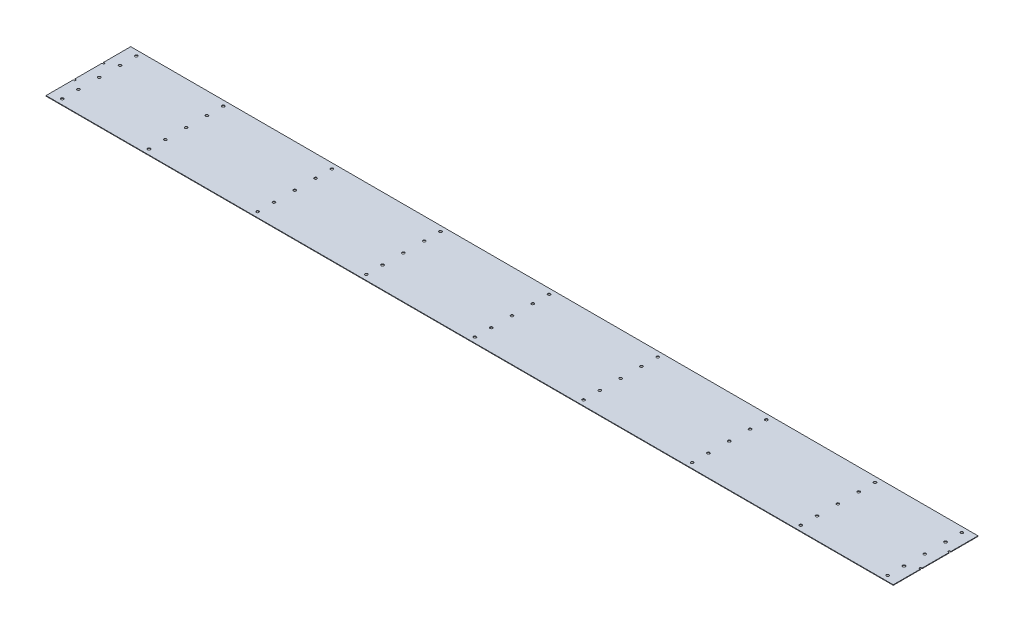
from build123d import *

# Parameters (mm, degrees)
SKETCH1_R           = 2.45
BOSS_EXTRUDE1_DEPTH = 1


with BuildPart() as part:
    # Sketch1 → Boss-Extrude1 (new body)
    with BuildSketch(Plane(origin=(0, 0, 0), x_dir=(1, 0, 0), z_dir=(0, 1, 0))):
        Polygon((-780, -25), (-780, 25), (-777, 25), (-777, 28), (-780, 28), (-780, 78), (780, 78), (780, 28), (777, 28), (777, 25), (780, 25), (780, -25), (777, -25), (777, -28), (780, -28), (780, -78), (-780, -78), (-780, -28), (-777, -28), (-777, -25), align=None)
        with Locations(Location((0, 68.3, 0), (0, 0, 270))):
            Circle(SKETCH1_R, mode=Mode.SUBTRACT)
        with Locations(Location((0, 38.3, 0), (0, 0, 270))):
            Circle(SKETCH1_R, mode=Mode.SUBTRACT)
        with Locations(Location((0, -38.3, 0), (0, 0, 270))):
            Circle(SKETCH1_R, mode=Mode.SUBTRACT)
        with Locations(Location((0, -68.3, 0), (0, 0, 270))):
            Circle(SKETCH1_R, mode=Mode.SUBTRACT)
        with Locations(Location((0, 0, 0), (0, 0, 270))):
            Circle(SKETCH1_R, mode=Mode.SUBTRACT)
        with Locations(Location((200, 68.3, 0), (0, 0, 270))):
            Circle(SKETCH1_R, mode=Mode.SUBTRACT)
        with Locations(Location((200, 38.3, 0), (0, 0, 270))):
            Circle(SKETCH1_R, mode=Mode.SUBTRACT)
        with Locations(Location((200, 0, 0), (0, 0, 270))):
            Circle(SKETCH1_R, mode=Mode.SUBTRACT)
        with Locations(Location((200, -38.3, 0), (0, 0, 270))):
            Circle(SKETCH1_R, mode=Mode.SUBTRACT)
        with Locations(Location((200, -68.3, 0), (0, 0, 270))):
            Circle(SKETCH1_R, mode=Mode.SUBTRACT)
        with Locations(Location((400, 68.3, 0), (0, 0, 270))):
            Circle(SKETCH1_R, mode=Mode.SUBTRACT)
        with Locations(Location((400, 38.3, 0), (0, 0, 270))):
            Circle(SKETCH1_R, mode=Mode.SUBTRACT)
        with Locations(Location((400, 0, 0), (0, 0, 270))):
            Circle(SKETCH1_R, mode=Mode.SUBTRACT)
        with Locations(Location((400, -38.3, 0), (0, 0, 270))):
            Circle(SKETCH1_R, mode=Mode.SUBTRACT)
        with Locations(Location((400, -68.3, 0), (0, 0, 270))):
            Circle(SKETCH1_R, mode=Mode.SUBTRACT)
        with Locations(Location((600, 68.3, 0), (0, 0, 270))):
            Circle(SKETCH1_R, mode=Mode.SUBTRACT)
        with Locations(Location((600, 38.3, 0), (0, 0, 270))):
            Circle(SKETCH1_R, mode=Mode.SUBTRACT)
        with Locations(Location((600, 0, 0), (0, 0, 270))):
            Circle(SKETCH1_R, mode=Mode.SUBTRACT)
        with Locations(Location((600, -38.3, 0), (0, 0, 270))):
            Circle(SKETCH1_R, mode=Mode.SUBTRACT)
        with Locations(Location((600, -68.3, 0), (0, 0, 270))):
            Circle(SKETCH1_R, mode=Mode.SUBTRACT)
        with Locations(Location((-200, -68.3, 0), (0, 0, 270))):
            Circle(SKETCH1_R, mode=Mode.SUBTRACT)
        with Locations(Location((-200, -38.3, 0), (0, 0, 270))):
            Circle(SKETCH1_R, mode=Mode.SUBTRACT)
        with Locations(Location((-200, 0, 0), (0, 0, 270))):
            Circle(SKETCH1_R, mode=Mode.SUBTRACT)
        with Locations(Location((-200, 38.3, 0), (0, 0, 270))):
            Circle(SKETCH1_R, mode=Mode.SUBTRACT)
        with Locations(Location((-200, 68.3, 0), (0, 0, 270))):
            Circle(SKETCH1_R, mode=Mode.SUBTRACT)
        with Locations(Location((-400, -68.3, 0), (0, 0, 270))):
            Circle(SKETCH1_R, mode=Mode.SUBTRACT)
        with Locations(Location((-400, -38.3, 0), (0, 0, 270))):
            Circle(SKETCH1_R, mode=Mode.SUBTRACT)
        with Locations(Location((-400, 0, 0), (0, 0, 270))):
            Circle(SKETCH1_R, mode=Mode.SUBTRACT)
        with Locations(Location((-400, 38.3, 0), (0, 0, 270))):
            Circle(SKETCH1_R, mode=Mode.SUBTRACT)
        with Locations(Location((-400, 68.3, 0), (0, 0, 270))):
            Circle(SKETCH1_R, mode=Mode.SUBTRACT)
        with Locations(Location((-600, -68.3, 0), (0, 0, 270))):
            Circle(SKETCH1_R, mode=Mode.SUBTRACT)
        with Locations(Location((-600, -38.3, 0), (0, 0, 270))):
            Circle(SKETCH1_R, mode=Mode.SUBTRACT)
        with Locations(Location((-600, 0, 0), (0, 0, 270))):
            Circle(SKETCH1_R, mode=Mode.SUBTRACT)
        with Locations(Location((-600, 38.3, 0), (0, 0, 270))):
            Circle(SKETCH1_R, mode=Mode.SUBTRACT)
        with Locations(Location((-600, 68.3, 0), (0, 0, 270))):
            Circle(SKETCH1_R, mode=Mode.SUBTRACT)
        with Locations(Location((-760, 68.3, 0), (0, 0, 270))):
            Circle(SKETCH1_R, mode=Mode.SUBTRACT)
        with Locations(Location((-760, 38.3, 0), (0, 0, 270))):
            Circle(SKETCH1_R, mode=Mode.SUBTRACT)
        with Locations(Location((-760, 0, 0), (0, 0, 270))):
            Circle(SKETCH1_R, mode=Mode.SUBTRACT)
        with Locations(Location((-760, -68.3, 0), (0, 0, 270))):
            Circle(SKETCH1_R, mode=Mode.SUBTRACT)
        with Locations(Location((-760, -38.3, 0), (0, 0, 270))):
            Circle(SKETCH1_R, mode=Mode.SUBTRACT)
        with Locations(Location((760, -68.3, 0), (0, 0, 270))):
            Circle(SKETCH1_R, mode=Mode.SUBTRACT)
        with Locations(Location((760, 0, 0), (0, 0, 270))):
            Circle(SKETCH1_R, mode=Mode.SUBTRACT)
        with Locations(Location((760, 68.3, 0), (0, 0, 270))):
            Circle(SKETCH1_R, mode=Mode.SUBTRACT)
        with Locations(Location((760, 38.3, 0), (0, 0, 270))):
            Circle(SKETCH1_R, mode=Mode.SUBTRACT)
        with Locations(Location((760, -38.3, 0), (0, 0, 270))):
            Circle(SKETCH1_R, mode=Mode.SUBTRACT)
    extrude(amount=BOSS_EXTRUDE1_DEPTH)


solid = part.part
